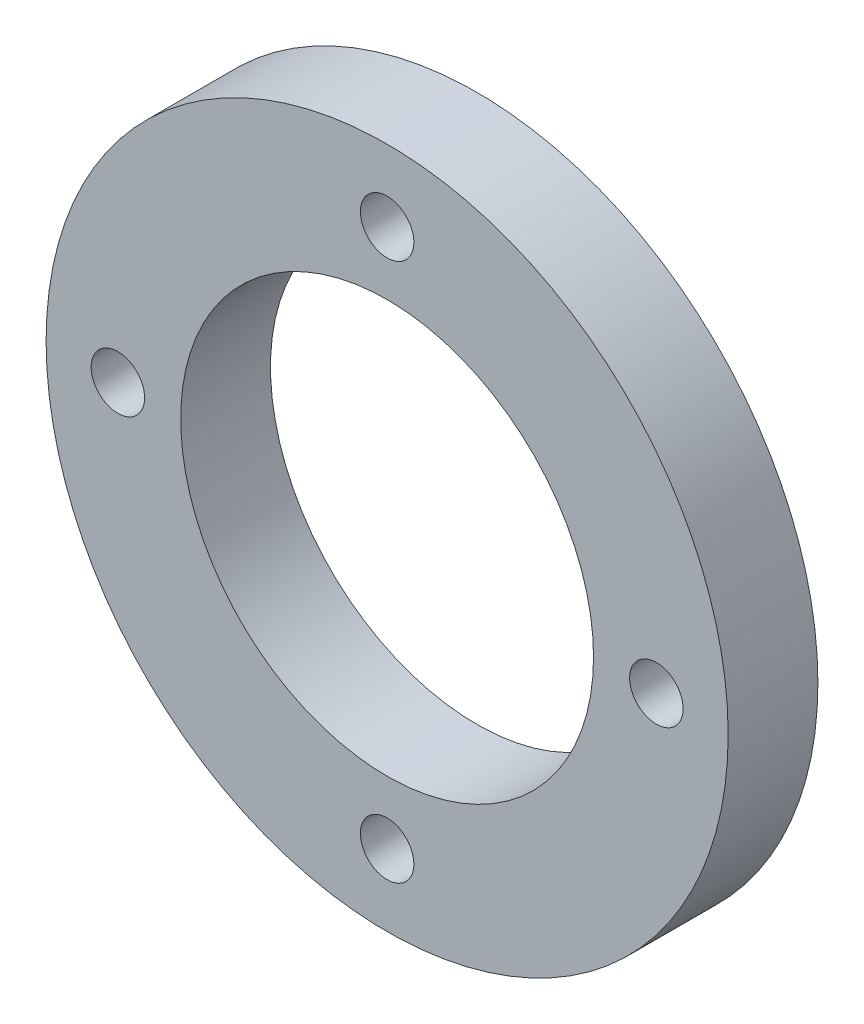
from build123d import *

# Parameters (mm, degrees)
SKETCH1_R           = 19
SKETCH1_R_2         = 1.49
SKETCH1_R_3         = 11.5
BOSS_EXTRUDE1_DEPTH = 5


with BuildPart() as part:
    # Sketch1 → Boss-Extrude1 (new body)
    with BuildSketch(Plane.XY):
        Circle(SKETCH1_R)
        with Locations((-15, 0)):
            Circle(SKETCH1_R_2, mode=Mode.SUBTRACT)
        with Locations((0, -15)):
            Circle(SKETCH1_R_2, mode=Mode.SUBTRACT)
        with Locations((15, 0)):
            Circle(SKETCH1_R_2, mode=Mode.SUBTRACT)
        with Locations((0, 15)):
            Circle(SKETCH1_R_2, mode=Mode.SUBTRACT)
        Circle(SKETCH1_R_3, mode=Mode.SUBTRACT)
    extrude(amount=BOSS_EXTRUDE1_DEPTH)


solid = part.part
